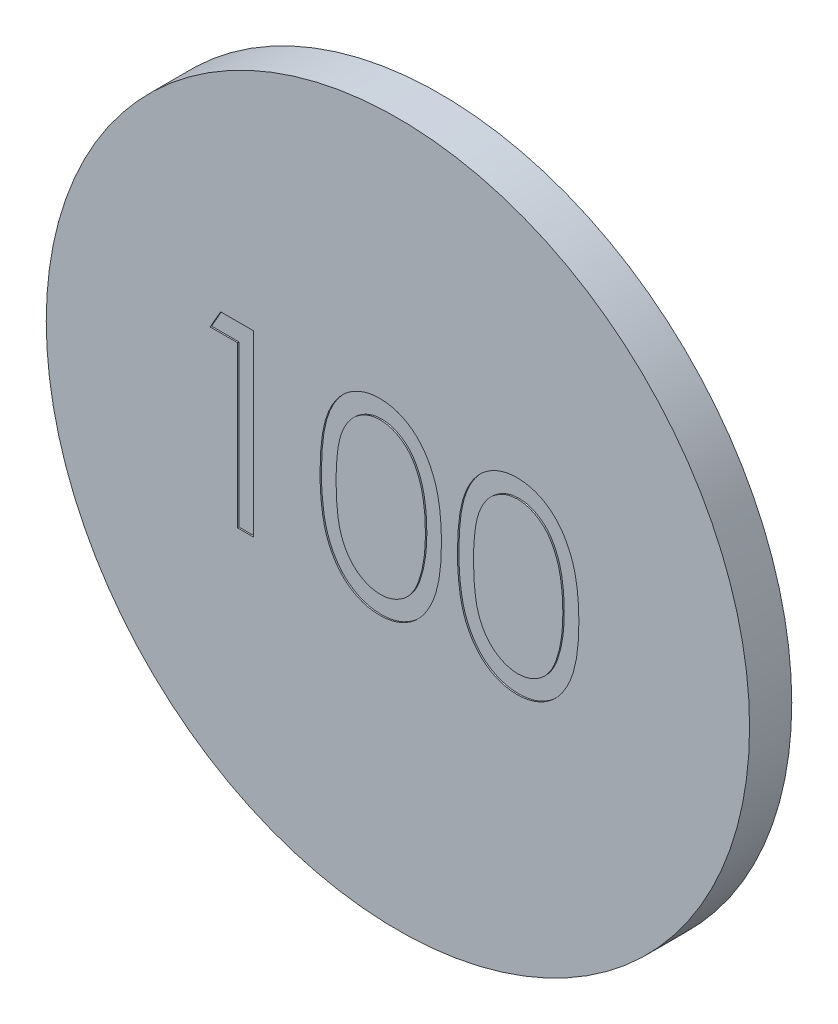
from build123d import *

# Parameters (mm, degrees)
SKETCH1_R           = 25
BOSS_EXTRUDE1_DEPTH = 3
CUT_EXTRUDE4_DEPTH  = 0.1


with BuildPart() as part:
    # Sketch1 → Boss-Extrude1 (new body)
    with BuildSketch(Plane(origin=(0, 0, 0), x_dir=(0, 1, 0), z_dir=(0, 0, 1))):
        with Locations(Location((0, 0, 0), (0, 0, 270))):
            Circle(SKETCH1_R)
    extrude(amount=BOSS_EXTRUDE1_DEPTH)

    # Sketch9 → Cut-Extrude4 (cut)
    # profile 1 of 3: a face of its own
    with BuildSketch(Plane.XY.offset(3)):
        Polygon((-12.602963393, 6.774284991), (-10.254786309, 6.774284991), (-10.254786309, -5.925715009), (-11.394529899, -5.925715009), (-11.394529899, 5.471720889), (-13.348376053, 5.471720889), align=None)
    # profile 2 of 3: a face of its own
    with BuildSketch(Plane.XY.offset(3)):
        with BuildLine():
            add(Edge.make_bspline(
                [(-5.532991438, 0.41919685), (-5.5318012, 0.622750228), (-5.529489147, 1.0181556), (-5.503768305, 1.594317015), (-5.461040635, 2.134830064), (-5.402485025, 2.639720618), (-5.331227211, 3.109119021), (-5.236102445, 3.541770854), (-5.127924561, 3.939678569), (-5.002548544, 4.304139716), (-4.861078566, 4.640064525), (-4.70710282, 4.953664541), (-4.534510566, 5.244465267), (-4.353165768, 5.517108106), (-4.155727679, 5.767130084), (-3.947814925, 5.998062031), (-3.721312689, 6.204566754), (-3.48392063, 6.392694766), (-3.233489459, 6.55761142), (-2.977157499, 6.702873072), (-2.713160401, 6.826969733), (-2.440777394, 6.9245436), (-2.162456684, 7.005137244), (-1.877225328, 7.060251426), (-1.584612379, 7.094929351), (-1.38710403, 7.098244659), (-1.286937752, 7.099926017)],
                knots=[0, 0, 0, 0, 1.646270934, 3.197905019, 4.663502075, 6.030701355, 7.308322542, 8.50163776, 9.611534131, 10.641858119, 11.616356847, 12.558055219, 13.465016945, 14.349605745, 15.204443733, 16.039544428, 16.859896111, 17.680448484, 18.487036065, 19.28249412, 20.06191084, 20.843045899, 21.620316918, 22.403196591, 23.190181807, 24, 24, 24, 24], degree=3))
            add(Edge.make_bspline(
                [(-1.286937752, 7.099926017), (-1.18593473, 7.098155945), (-0.985071497, 7.094635828), (-0.68810785, 7.060803236), (-0.398004719, 7.004665161), (-0.115998902, 6.925123339), (0.160226049, 6.826441884), (0.428509586, 6.702754345), (0.690518139, 6.55877674), (0.942088039, 6.389598671), (1.185981072, 6.200977269), (1.416206538, 5.987752728), (1.632785392, 5.752078032), (1.838435786, 5.496474698), (2.027323239, 5.216040247), (2.207203979, 4.915652191), (2.36821108, 4.590057339), (2.523276902, 4.244688213), (2.657123968, 3.869988651), (2.777832915, 3.468070806), (2.875365172, 3.034187328), (2.956606246, 2.570614666), (3.01954344, 2.07565037), (3.065381884, 1.550355453), (3.08959565, 0.994384322), (3.09415568, 0.614262983), (3.096495742, 0.41919685)],
                knots=[0, 0, 0, 0, 0.810914788, 1.612654377, 2.396697861, 3.181598691, 3.963628158, 4.749916497, 5.551656086, 6.361998678, 7.18212741, 8.025565596, 8.878627764, 9.750805457, 10.657531673, 11.591944965, 12.560506719, 13.57287815, 14.630710178, 15.753379473, 16.941251878, 18.199788006, 19.531962791, 20.947069417, 22.433333509, 24, 24, 24, 24], degree=3))
            add(Edge.make_bspline(
                [(3.096495742, 0.41919685), (3.094131421, 0.224981527), (3.089524638, -0.15343911), (3.06565333, -0.706908649), (3.018632011, -1.229415834), (2.959812911, -1.722213798), (2.878347988, -2.183251444), (2.778180671, -2.614124157), (2.666963785, -3.016692645), (2.529677532, -3.387658962), (2.379415812, -3.73219807), (2.215929814, -4.053933151), (2.040779302, -4.355707985), (1.849957285, -4.635107067), (1.646563471, -4.894109622), (1.426244638, -5.128143853), (1.195211372, -5.342848863), (0.950600606, -5.533899054), (0.695107263, -5.701121059), (0.433998612, -5.850668459), (0.162641764, -5.971255667), (-0.112813807, -6.074797101), (-0.396308164, -6.153901598), (-0.687487925, -6.20859816), (-0.984871981, -6.246958867), (-1.185900517, -6.249885237), (-1.286937752, -6.251356034)],
                knots=[0, 0, 0, 0, 1.561518951, 3.042555995, 4.452378317, 5.7783523, 7.031515105, 8.214008947, 9.334062868, 10.386615937, 11.391082383, 12.354592575, 13.286541444, 14.194233754, 15.072674879, 15.931287219, 16.775624067, 17.606195743, 18.42308326, 19.229000347, 20.022332153, 20.807536673, 21.593273796, 22.3848459, 23.188221202, 24, 24, 24, 24], degree=3))
            add(Edge.make_bspline(
                [(-1.286937752, -6.251356034), (-1.387101251, -6.24966383), (-1.584604121, -6.246327134), (-1.877257207, -6.21180588), (-2.161310645, -6.156305054), (-2.438166124, -6.078593376), (-2.70924405, -5.98347097), (-2.970850576, -5.85954189), (-3.225894457, -5.716815411), (-3.473695246, -5.554272025), (-3.709596516, -5.368047632), (-3.934925741, -5.162074355), (-4.144022239, -4.931212263), (-4.338637386, -4.679106656), (-4.523600506, -4.408076891), (-4.693741946, -4.114422509), (-4.851116188, -3.799307894), (-4.994965425, -3.460697189), (-5.122504862, -3.093649308), (-5.235163688, -2.693965146), (-5.32411506, -2.258116981), (-5.400253212, -1.789605392), (-5.461664545, -1.28641713), (-5.503590239, -0.748279021), (-5.529503011, -0.175526405), (-5.531807409, 0.217338204), (-5.532991438, 0.41919685)],
                knots=[0, 0, 0, 0, 0.810891512, 1.598919785, 2.382837074, 3.152667961, 3.926044502, 4.706494248, 5.493654104, 6.291793342, 7.103789334, 7.925228297, 8.761435821, 9.622817696, 10.50288917, 11.416980706, 12.369136599, 13.353924996, 14.394355917, 15.514179734, 16.714354668, 17.994756427, 19.357759367, 20.818452758, 22.365282078, 24, 24, 24, 24], degree=3))
        make_face()
        with BuildLine():
            add(Edge.make_bspline(
                [(-4.393247848, 0.424284991), (-4.392814426, 0.254653998), (-4.391973238, -0.07456645), (-4.369997882, -0.55296914), (-4.340061326, -0.999175761), (-4.301448619, -1.413752879), (-4.244106491, -1.795297211), (-4.179856147, -2.146432918), (-4.101667364, -2.46530175), (-4.009156871, -2.754091806), (-3.903786434, -3.01770414), (-3.788739443, -3.262999978), (-3.665147677, -3.492877004), (-3.526829616, -3.705270383), (-3.376189244, -3.90087275), (-3.216629132, -4.08314617), (-3.042194327, -4.245695216), (-2.800880746, -4.440646948), (-2.482304968, -4.64210209), (-2.080910745, -4.81752933), (-1.668456651, -4.927774244), (-1.388507829, -4.941794158), (-1.248776694, -4.948791932)],
                knots=[0, 0, 0, 0, 1.459021318, 2.831673884, 4.118529203, 5.306027144, 6.411944654, 7.436330062, 8.375795394, 9.233974572, 10.042671642, 10.816086306, 11.563610507, 12.285937304, 12.993564865, 13.685989202, 14.367179055, 15.041617293, 16.353048772, 17.594441528, 18.799311195, 20, 20, 20, 20], degree=3))
            add(Edge.make_bspline(
                [(-1.248776694, -4.948791932), (-1.108141714, -4.94299427), (-0.827162113, -4.931410917), (-0.416648056, -4.819655498), (-0.018121076, -4.651037455), (0.294197107, -4.451656507), (0.531805194, -4.261779425), (0.702046844, -4.099891987), (0.858300562, -3.918623555), (1.006498948, -3.723046109), (1.14242188, -3.509423095), (1.266022408, -3.278781751), (1.378810555, -3.030481591), (1.443069093, -2.85714568), (1.475922825, -2.768523502)],
                knots=[0, 0, 0, 0, 1.353760809, 2.704726607, 4.075137775, 5.516104923, 6.260822281, 7.007110065, 7.778089737, 8.566572457, 9.372053459, 10.217411131, 11.088608312, 12, 12, 12, 12], degree=3))
            add(Edge.make_bspline(
                [(1.475922825, -2.768523502), (1.514210668, -2.655204162), (1.59195141, -2.425117303), (1.692142705, -2.068197766), (1.77104744, -1.693719165), (1.84203451, -1.303919456), (1.890487027, -0.895923969), (1.929486235, -0.470995091), (1.952457585, -0.028812433), (1.95530511, 0.271615106), (1.956752152, 0.424284991)],
                knots=[0, 0, 0, 0, 0.884706709, 1.796334032, 2.740027952, 3.714592787, 4.726048262, 5.777819803, 6.87074269, 8, 8, 8, 8], degree=3))
            add(Edge.make_bspline(
                [(1.956752152, 0.424284991), (1.954755751, 0.576930183), (1.950850364, 0.875536809), (1.935922466, 1.312845636), (1.897374067, 1.728200083), (1.854560122, 2.123389512), (1.791433062, 2.496226325), (1.72336902, 2.849831718), (1.631924621, 3.17982498), (1.534244295, 3.491372605), (1.422446574, 3.78093498), (1.29938091, 4.049862148), (1.167947671, 4.299452435), (1.025191541, 4.529021051), (0.872807205, 4.739596278), (0.70677267, 4.926956093), (0.533673945, 5.096907377), (0.291223014, 5.290900128), (-0.026183695, 5.488699709), (-0.421137901, 5.670729752), (-0.832148524, 5.775262699), (-1.110000772, 5.790000821), (-1.248776694, 5.797361914)],
                knots=[0, 0, 0, 0, 1.31362396, 2.569729283, 3.763502607, 4.902122613, 5.988968491, 7.01645872, 7.998833611, 8.933434873, 9.825090667, 10.667526885, 11.477055099, 12.250526234, 12.991942729, 13.710640831, 14.402115721, 15.076753259, 16.378508321, 17.609869233, 18.806226677, 20, 20, 20, 20], degree=3))
            add(Edge.make_bspline(
                [(-1.248776694, 5.797361914), (-1.389240842, 5.789990665), (-1.670425031, 5.775234738), (-2.08570761, 5.671119218), (-2.483777686, 5.489643598), (-2.800345051, 5.29024499), (-3.042965076, 5.100331688), (-3.213807992, 4.935643698), (-3.373995532, 4.755498718), (-3.521561186, 4.558097484), (-3.659770871, 4.345951722), (-3.786701974, 4.11739249), (-3.901064856, 3.87126154), (-4.006600173, 3.607767617), (-4.099392861, 3.319002476), (-4.175933813, 3.000526414), (-4.246643977, 2.650507549), (-4.296701096, 2.266896763), (-4.34120101, 1.852215807), (-4.369799044, 1.404895252), (-4.392046749, 0.925690214), (-4.392839463, 0.594767554), (-4.393247848, 0.424284991)],
                knots=[0, 0, 0, 0, 1.207732386, 2.417664972, 3.655092373, 4.956220595, 5.625982001, 6.301752483, 6.994047911, 7.697131622, 8.419323945, 9.170223765, 9.943494443, 10.752040957, 11.610060368, 12.549350801, 13.567764191, 14.679664412, 15.874934091, 17.154273443, 18.533957287, 20, 20, 20, 20], degree=3))
        make_face(mode=Mode.SUBTRACT)
    # profile 3 of 3: a face of its own
    with BuildSketch(Plane.XY.offset(3)):
        with BuildLine():
            add(Edge.make_bspline(
                [(4.236239332, 0.41919685), (4.237429569, 0.622750228), (4.239741622, 1.0181556), (4.265462464, 1.594317015), (4.308190135, 2.134830064), (4.366745745, 2.639720618), (4.438003559, 3.109119021), (4.533128324, 3.541770854), (4.641306208, 3.939678569), (4.766682226, 4.304139716), (4.908152203, 4.640064525), (5.062127949, 4.953664541), (5.234720203, 5.244465267), (5.416065001, 5.517108106), (5.61350309, 5.767130084), (5.821415844, 5.998062031), (6.047918081, 6.204566754), (6.285310139, 6.392694766), (6.53574131, 6.55761142), (6.79207327, 6.702873072), (7.056070368, 6.826969733), (7.328453375, 6.9245436), (7.606774085, 7.005137244), (7.892005441, 7.060251426), (8.18461839, 7.094929351), (8.38212674, 7.098244659), (8.482293018, 7.099926017)],
                knots=[0, 0, 0, 0, 1.646270934, 3.197905019, 4.663502075, 6.030701355, 7.308322542, 8.50163776, 9.611534131, 10.641858119, 11.616356847, 12.558055219, 13.465016945, 14.349605745, 15.204443733, 16.039544428, 16.859896111, 17.680448484, 18.487036065, 19.28249412, 20.06191084, 20.843045899, 21.620316918, 22.403196591, 23.190181807, 24, 24, 24, 24], degree=3))
            add(Edge.make_bspline(
                [(8.482293018, 7.099926017), (8.58329604, 7.098155945), (8.784159272, 7.094635828), (9.081122919, 7.060803236), (9.37122605, 7.004665161), (9.653231868, 6.925123339), (9.929456818, 6.826441884), (10.197740355, 6.702754345), (10.459748908, 6.55877674), (10.711318809, 6.389598671), (10.955211841, 6.200977269), (11.185437307, 5.987752728), (11.402016162, 5.752078032), (11.607666555, 5.496474698), (11.796554008, 5.216040247), (11.976434748, 4.915652191), (12.13744185, 4.590057339), (12.292507671, 4.244688213), (12.426354737, 3.869988651), (12.547063684, 3.468070806), (12.644595942, 3.034187328), (12.725837016, 2.570614666), (12.788774209, 2.07565037), (12.834612654, 1.550355453), (12.858826419, 0.994384322), (12.863386449, 0.614262983), (12.865726511, 0.41919685)],
                knots=[0, 0, 0, 0, 0.810914788, 1.612654377, 2.396697861, 3.181598691, 3.963628158, 4.749916497, 5.551656086, 6.361998678, 7.18212741, 8.025565596, 8.878627764, 9.750805457, 10.657531673, 11.591944965, 12.560506719, 13.57287815, 14.630710178, 15.753379473, 16.941251878, 18.199788006, 19.531962791, 20.947069417, 22.433333509, 24, 24, 24, 24], degree=3))
            add(Edge.make_bspline(
                [(12.865726511, 0.41919685), (12.86336219, 0.224981527), (12.858755407, -0.15343911), (12.8348841, -0.706908649), (12.787862781, -1.229415834), (12.72904368, -1.722213798), (12.647578758, -2.183251444), (12.54741144, -2.614124157), (12.436194554, -3.016692645), (12.298908301, -3.387658962), (12.148646581, -3.73219807), (11.985160583, -4.053933151), (11.810010072, -4.355707985), (11.619188054, -4.635107067), (11.41579424, -4.894109622), (11.195475407, -5.128143853), (10.964442141, -5.342848863), (10.719831375, -5.533899054), (10.464338032, -5.701121059), (10.203229381, -5.850668459), (9.931872533, -5.971255667), (9.656416962, -6.074797101), (9.372922605, -6.153901598), (9.081742844, -6.20859816), (8.784358788, -6.246958867), (8.583330252, -6.249885237), (8.482293018, -6.251356034)],
                knots=[0, 0, 0, 0, 1.561518951, 3.042555995, 4.452378317, 5.7783523, 7.031515105, 8.214008947, 9.334062868, 10.386615937, 11.391082383, 12.354592575, 13.286541444, 14.194233754, 15.072674879, 15.931287219, 16.775624067, 17.606195743, 18.42308326, 19.229000347, 20.022332153, 20.807536673, 21.593273796, 22.3848459, 23.188221202, 24, 24, 24, 24], degree=3))
            add(Edge.make_bspline(
                [(8.482293018, -6.251356034), (8.382129518, -6.24966383), (8.184626648, -6.246327134), (7.891973562, -6.21180588), (7.607920124, -6.156305054), (7.331064645, -6.078593376), (7.059986719, -5.98347097), (6.798380193, -5.85954189), (6.543336312, -5.716815411), (6.295535523, -5.554272025), (6.059634253, -5.368047632), (5.834305028, -5.162074355), (5.625208531, -4.931212263), (5.430593384, -4.679106656), (5.245630264, -4.408076891), (5.075488823, -4.114422509), (4.918114581, -3.799307894), (4.774265344, -3.460697189), (4.646725908, -3.093649308), (4.534067081, -2.693965146), (4.44511571, -2.258116981), (4.368977557, -1.789605392), (4.307566225, -1.28641713), (4.26564053, -0.748279021), (4.239727758, -0.175526405), (4.23742336, 0.217338204), (4.236239332, 0.41919685)],
                knots=[0, 0, 0, 0, 0.810891512, 1.598919785, 2.382837074, 3.152667961, 3.926044502, 4.706494248, 5.493654104, 6.291793342, 7.103789334, 7.925228297, 8.761435821, 9.622817696, 10.50288917, 11.416980706, 12.369136599, 13.353924996, 14.394355917, 15.514179734, 16.714354668, 17.994756427, 19.357759367, 20.818452758, 22.365282078, 24, 24, 24, 24], degree=3))
        make_face()
        with BuildLine():
            add(Edge.make_bspline(
                [(5.375982921, 0.424284991), (5.376416344, 0.254653998), (5.377257531, -0.07456645), (5.399232887, -0.55296914), (5.429169444, -0.999175761), (5.467782151, -1.413752879), (5.525124278, -1.795297211), (5.589374622, -2.146432918), (5.667563405, -2.46530175), (5.760073898, -2.754091806), (5.865444335, -3.01770414), (5.980491326, -3.262999978), (6.104083092, -3.492877004), (6.242401153, -3.705270383), (6.393041525, -3.90087275), (6.552601637, -4.08314617), (6.727036443, -4.245695216), (6.968350023, -4.440646948), (7.286925801, -4.64210209), (7.688320025, -4.81752933), (8.100774118, -4.927774244), (8.38072294, -4.941794158), (8.520454075, -4.948791932)],
                knots=[0, 0, 0, 0, 1.459021318, 2.831673884, 4.118529203, 5.306027144, 6.411944654, 7.436330062, 8.375795394, 9.233974572, 10.042671642, 10.816086306, 11.563610507, 12.285937304, 12.993564865, 13.685989202, 14.367179055, 15.041617293, 16.353048772, 17.594441528, 18.799311195, 20, 20, 20, 20], degree=3))
            add(Edge.make_bspline(
                [(8.520454075, -4.948791932), (8.661089055, -4.94299427), (8.942068657, -4.931410917), (9.352582713, -4.819655498), (9.751109693, -4.651037455), (10.063427877, -4.451656507), (10.301035963, -4.261779425), (10.471277613, -4.099891987), (10.627531331, -3.918623555), (10.775729717, -3.723046109), (10.911652649, -3.509423095), (11.035253177, -3.278781751), (11.148041324, -3.030481591), (11.212299862, -2.85714568), (11.245153595, -2.768523502)],
                knots=[0, 0, 0, 0, 1.353760809, 2.704726607, 4.075137775, 5.516104923, 6.260822281, 7.007110065, 7.778089737, 8.566572457, 9.372053459, 10.217411131, 11.088608312, 12, 12, 12, 12], degree=3))
            add(Edge.make_bspline(
                [(11.245153595, -2.768523502), (11.283441438, -2.655204162), (11.361182179, -2.425117303), (11.461373475, -2.068197766), (11.540278209, -1.693719165), (11.611265279, -1.303919456), (11.659717796, -0.895923969), (11.698717004, -0.470995091), (11.721688354, -0.028812433), (11.724535879, 0.271615106), (11.725982921, 0.424284991)],
                knots=[0, 0, 0, 0, 0.884706709, 1.796334032, 2.740027952, 3.714592787, 4.726048262, 5.777819803, 6.87074269, 8, 8, 8, 8], degree=3))
            add(Edge.make_bspline(
                [(11.725982921, 0.424284991), (11.723986521, 0.576930183), (11.720081134, 0.875536809), (11.705153235, 1.312845636), (11.666604836, 1.728200083), (11.623790891, 2.123389512), (11.560663831, 2.496226325), (11.492599789, 2.849831718), (11.40115539, 3.17982498), (11.303475064, 3.491372605), (11.191677343, 3.78093498), (11.068611679, 4.049862148), (10.93717844, 4.299452435), (10.79442231, 4.529021051), (10.642037975, 4.739596278), (10.476003439, 4.926956093), (10.302904715, 5.096907377), (10.060453783, 5.290900128), (9.743047075, 5.488699709), (9.348092869, 5.670729752), (8.937082245, 5.775262699), (8.659229997, 5.790000821), (8.520454075, 5.797361914)],
                knots=[0, 0, 0, 0, 1.31362396, 2.569729283, 3.763502607, 4.902122613, 5.988968491, 7.01645872, 7.998833611, 8.933434873, 9.825090667, 10.667526885, 11.477055099, 12.250526234, 12.991942729, 13.710640831, 14.402115721, 15.076753259, 16.378508321, 17.609869233, 18.806226677, 20, 20, 20, 20], degree=3))
            add(Edge.make_bspline(
                [(8.520454075, 5.797361914), (8.379989927, 5.789990665), (8.098805738, 5.775234738), (7.683523159, 5.671119218), (7.285453083, 5.489643598), (6.968885718, 5.29024499), (6.726265693, 5.100331688), (6.555422777, 4.935643698), (6.395235238, 4.755498718), (6.247669583, 4.558097484), (6.109459898, 4.345951722), (5.982528795, 4.11739249), (5.868165913, 3.87126154), (5.762630596, 3.607767617), (5.669837908, 3.319002476), (5.593296956, 3.000526414), (5.522586792, 2.650507549), (5.472529673, 2.266896763), (5.42802976, 1.852215807), (5.399431726, 1.404895252), (5.37718402, 0.925690214), (5.376391306, 0.594767554), (5.375982921, 0.424284991)],
                knots=[0, 0, 0, 0, 1.207732386, 2.417664972, 3.655092373, 4.956220595, 5.625982001, 6.301752483, 6.994047911, 7.697131622, 8.419323945, 9.170223765, 9.943494443, 10.752040957, 11.610060368, 12.549350801, 13.567764191, 14.679664412, 15.874934091, 17.154273443, 18.533957287, 20, 20, 20, 20], degree=3))
        make_face(mode=Mode.SUBTRACT)
    extrude(amount=-CUT_EXTRUDE4_DEPTH, mode=Mode.SUBTRACT)


solid = part.part
